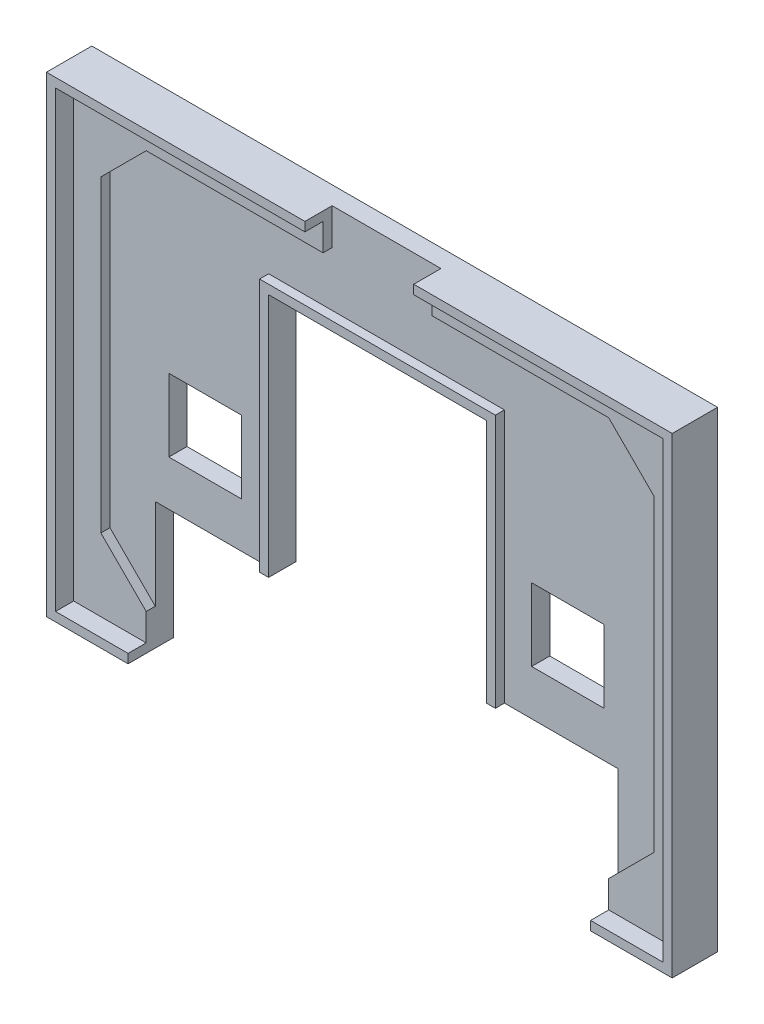
from build123d import *

# Parameters (mm, degrees)
SKICA1_W                    = 67
SKICA1_H                    = 50
P_IDAT_VYSUNUT_M1_DEPTH     = 3
ODEBRAT_VYSUNUT_M1_DEPTH    = 1
SKICA3_W                    = 8
SKICA3_H                    = 8
ODEBRAT_VYSUNUT_M2_DEPTH    = 42.907636536
VYSUNOUT_TENKOST_NN_1_DEPTH = 1
VYSUNOUT_TENKOST_NN_2_DEPTH = 5
SKICA6_W                    = 12
SKICA6_H                    = 4
ODEBRAT_VYSUNUT_M3_DEPTH    = 44.304156844
SKICA7_W                    = 5
SKICA7_H                    = 5
ODEBRAT_VYSUNUT_M5_DEPTH    = 1
P_IDAT_START                = -1
SKICA8_W                    = 1.6
SKICA8_H                    = 0.8
SKICA8_H_2                  = 2.4
P_IDAT_VYSUNUT_M3_DEPTH     = 1


with BuildPart() as part:
    # Skica1 → Přidat vysunutím1 (new body)
    with BuildSketch(Plane.XY):
        Rectangle(SKICA1_W, SKICA1_H)
    extrude(amount=P_IDAT_VYSUNUT_M1_DEPTH)

    # Skica2 → Odebrat vysunutím1 (cut)
    with BuildSketch(Plane.XY.offset(3)):
        Polygon((-25.5, -22), (-30.5, -17), (-30.5, 17), (-25.5, 22), (25.5, 22), (30.5, 17), (30.5, -17), (25.5, -22), align=None)
    extrude(amount=-ODEBRAT_VYSUNUT_M1_DEPTH, mode=Mode.SUBTRACT)

    # Skica3 → Odebrat vysunutím2 (cut, through all)
    with BuildSketch(Plane(origin=(0, 0, 0), x_dir=(-1, 0, 0), z_dir=(0, 0, -1))):
        with Locations((20, -3)):
            Rectangle(SKICA3_W, SKICA3_H)
        with Locations((-20, -3)):
            Rectangle(SKICA3_W, SKICA3_H)
        Polygon((25.5, -25), (-25.5, -25), (-25.5, -12), (-12, -12), (-12, 15), (12, 15), (12, -12), (25.5, -12), align=None)
    extrude(amount=-ODEBRAT_VYSUNUT_M2_DEPTH, mode=Mode.SUBTRACT)

    # Skica4 → Vysunout tenkostěnný1 (add)
    with BuildSketch(Plane.XY.offset(2)):
        Polygon((-12, -12), (-12, 15), (12, 15), (12, -12), (13, -12), (13, 16), (-13, 16), (-13, -12), align=None)
    extrude(amount=VYSUNOUT_TENKOST_NN_1_DEPTH)

    # Skica5 → Vysunout tenkostěnný2 (add)
    with BuildSketch(Plane(origin=(0, 0, 0), x_dir=(-1, 0, 0), z_dir=(0, 0, -1))):
        Polygon((-25.5, -25), (-33.5, -25), (-33.5, 25), (33.5, 25), (33.5, -25), (25.5, -25), (25.5, -26), (34.5, -26), (34.5, 26), (-34.5, 26), (-34.5, -26), (-25.5, -26), align=None)
    extrude(amount=-VYSUNOUT_TENKOST_NN_2_DEPTH)

    # Skica6 → Odebrat vysunutím3 (cut, through all)
    with BuildSketch(Plane.XY.offset(2)):
        with Locations((0, 24)):
            Rectangle(SKICA6_W, SKICA6_H)
    extrude(amount=ODEBRAT_VYSUNUT_M3_DEPTH, mode=Mode.SUBTRACT)

    # Skica7 → Odebrat vysunutím5 (cut)
    with BuildSketch(Plane(origin=(0, 0, 0), x_dir=(-1, 0, 0), z_dir=(0, 0, -1))):
        with Locations((-28, 18.5)):
            Rectangle(SKICA7_W, SKICA7_H)
        with Locations((-18.5, 18.5)):
            Rectangle(SKICA7_W, SKICA7_H)
        Polygon((-25.5, 15.99), (-25.5, 13.5), (-28, 13.5), (-28, 6), (-25.5, 6), (-25.5, 8.49), (-21, 8.49), (-21, 6), (-18.5, 6), (-18.5, 13.5), (-21, 13.5), (-21, 15.99), align=None)
        Polygon((21, 13.5), (18.5, 13.5), (18.5, 6), (21, 6), (21, 8.49), (25.5, 8.49), (25.5, 6), (28, 6), (28, 13.5), (25.5, 13.5), (25.5, 15.99), (21, 15.99), align=None)
        with Locations((18.5, 18.5)):
            Rectangle(SKICA7_W, SKICA7_H)
        with Locations((28, 18.5)):
            Rectangle(SKICA7_W, SKICA7_H)
        Polygon((-11.2, 23.3), (-11.2, 17.7), (-7.2, 17.7), (-7.2, 18.5), (-6.4, 18.5), (-6.4, 20.1), (-7.2, 20.1), (-7.2, 20.9), (-6.4, 20.9), (-6.4, 22.5), (-7.2, 22.5), (-7.2, 23.3), align=None)
        Polygon((-1.6, 23.3), (-4.8, 23.3), (-4.8, 22.5), (-5.6, 22.5), (-5.6, 18.5), (-4.8, 18.5), (-4.8, 17.7), (-1.6, 17.7), (-1.6, 18.5), (-0.8, 18.5), (-0.8, 22.5), (-1.6, 22.5), align=None)
        Polygon((0.8, 23.3), (0.8, 22.5), (0, 22.5), (0, 18.5), (0.8, 18.5), (0.8, 17.7), (4, 17.7), (4, 18.5), (4.8, 18.5), (4.8, 22.5), (4, 22.5), (4, 23.3), align=None)
        Polygon((5.6, 17.7), (5.6, 23.3), (7.2, 23.3), (7.2, 22.5), (8, 22.5), (8, 21.7), (8.8, 21.7), (8.8, 22.5), (9.6, 22.5), (9.6, 23.3), (11.2, 23.3), (11.2, 17.7), (9.6, 17.7), (9.6, 19.3), (8.8, 19.3), (8.8, 18.5), (8, 18.5), (8, 19.3), (7.2, 19.3), (7.2, 17.7), align=None)
    extrude(amount=-ODEBRAT_VYSUNUT_M5_DEPTH, mode=Mode.SUBTRACT)

    # Skica8 → Přidat vysunutím3 (add)
    with BuildSketch(Plane(origin=(0, 0, 0), x_dir=(-1, 0, 0), z_dir=(0, 0, -1)).offset(P_IDAT_START)):
        with Locations((-8.8, 21.3)):
            Rectangle(SKICA8_W, SKICA8_H)
        with Locations((-8.8, 19.7)):
            Rectangle(SKICA8_W, SKICA8_H)
        with Locations((-3.2, 20.5)):
            Rectangle(SKICA8_W, SKICA8_H_2)
        with Locations((2.4, 20.5)):
            Rectangle(SKICA8_W, SKICA8_H_2)
    extrude(amount=P_IDAT_VYSUNUT_M3_DEPTH)


solid = part.part
